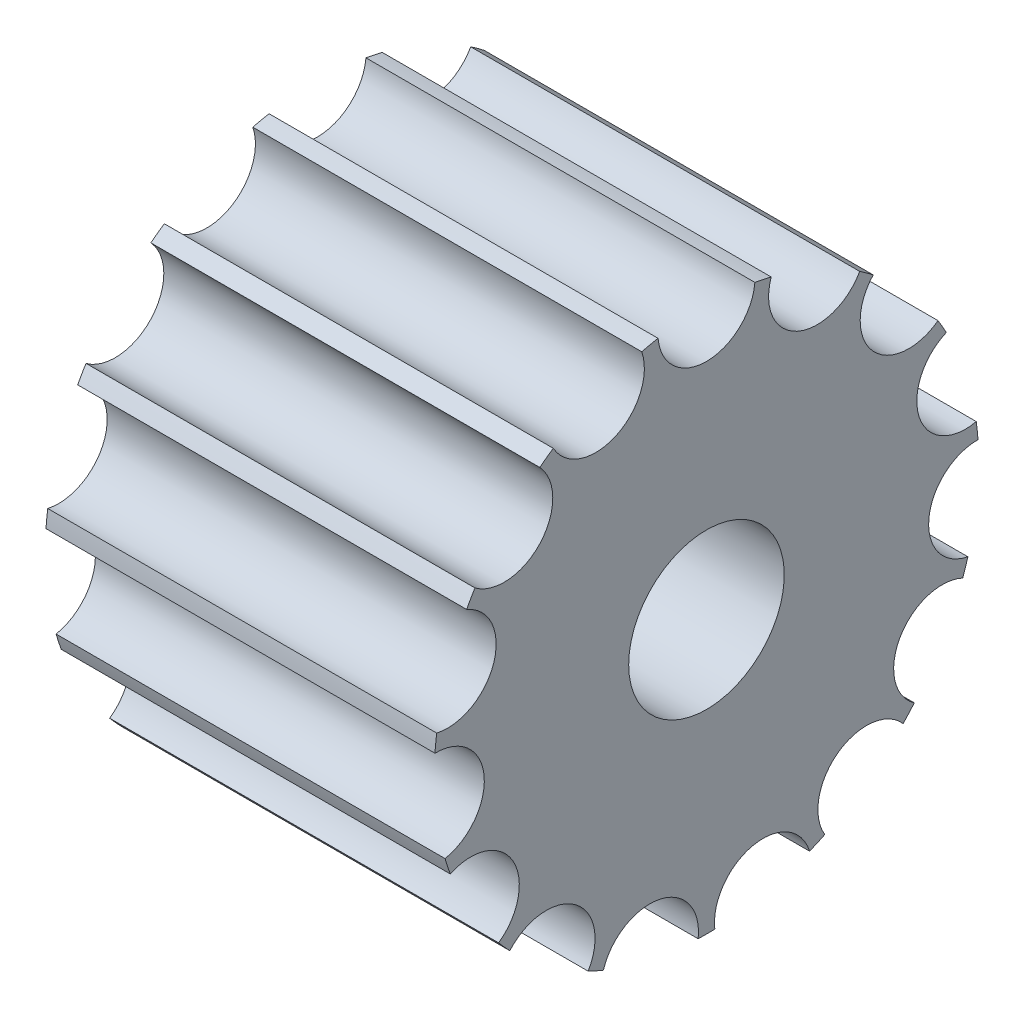
from build123d import *

# Parameters (mm, degrees)
SKETCH_3_R               = 2
CUT_EXTRUDE_2_DEPTH      = 17
SKETCH_4_W               = 2.5
SKETCH_4_H               = 2.683329606
CUT_EXTRUDE_3_DEPTH      = 17
PATTERN_CIRCULAR_1_COUNT = 15


with BuildPart() as part:
    # 草图1 → 旋转2 (revolve)
    with BuildSketch(Plane.XY, mode=Mode.PRIVATE) as revolve_2_sk:
        Polygon((-27.363734917, 8.847191366), (-27.363734917, 3.847191366), (-28.613734917, 3.847191366), (-28.613734917, 1.847191366), (-16.113734917, 1.847191366), (-16.113734917, 3.847191366), (-17.363734917, 3.847191366), (-17.363734917, 8.847191366), align=None)
    revolve(revolve_2_sk.sketch.rotate(Axis((-48.964491856, 1.847191366, 0), (1, 0, 0)), 90), axis=Axis((-48.964491856, 1.847191366, 0), (1, 0, 0)))

    # 草图3 → 切除-拉伸2 (cut)
    with BuildSketch(Plane.ZY.offset(28.613734917)):
        with Locations((0, 1.847191366)):
            Circle(SKETCH_3_R)
    extrude(amount=-CUT_EXTRUDE_2_DEPTH, mode=Mode.SUBTRACT)

    # 草图4 → 切除-拉伸3 (cut)
    with BuildSketch(Plane.ZY.offset(27.363734917)):
        with Locations((0, 10.188856169)):
            Rectangle(SKETCH_4_W, SKETCH_4_H)
        with BuildLine():
            Line((1.25, 8.847191366), (-1.25, 8.847191366))
            ThreePointArc((-1.25, 8.847191366), (0, 7.597191366), (1.25, 8.847191366))
        make_face()
    cut_extrude_3 = extrude(amount=-CUT_EXTRUDE_3_DEPTH, mode=Mode.SUBTRACT)

    # 阵列(圆周)1: 切除-拉伸3 ×15 about axis
    pattern_circular_1_axis = Axis((0, 1.847191366, 0), (1, 0, 0))
    for i in range(1, PATTERN_CIRCULAR_1_COUNT):
        add(cut_extrude_3.rotate(pattern_circular_1_axis, i * 360 / PATTERN_CIRCULAR_1_COUNT), mode=Mode.SUBTRACT)


solid = part.part
